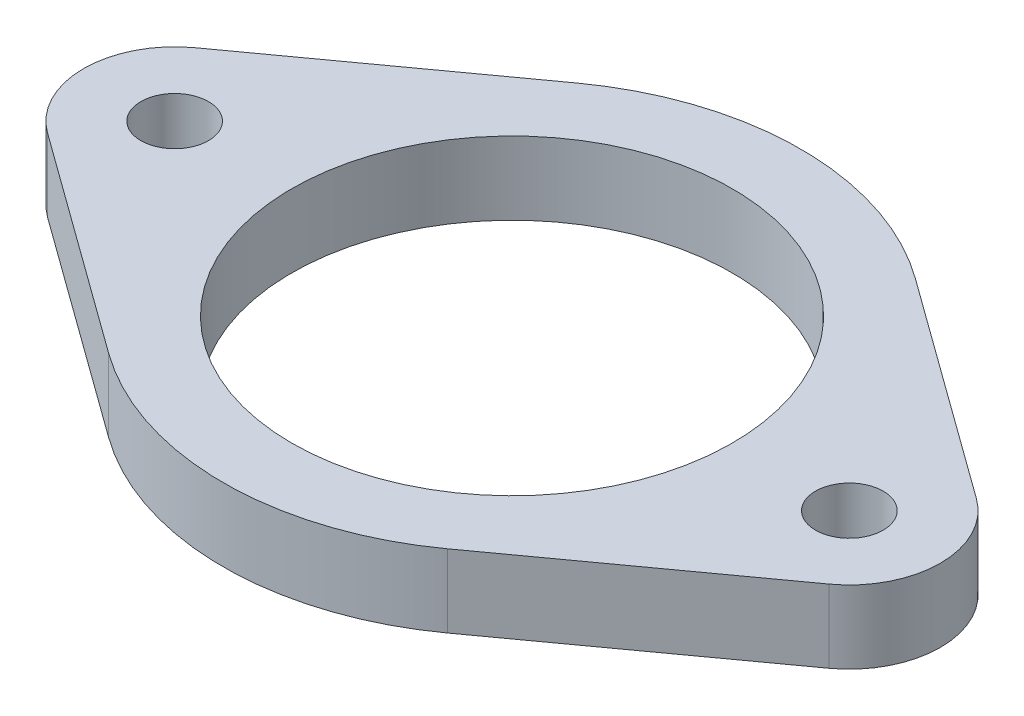
from build123d import *

# Parameters (mm, degrees)
SKETCH1_R           = 9.5885
SKETCH1_R_2         = 1.4732
BOSS_EXTRUDE1_DEPTH = 3.175


with BuildPart() as part:
    # Sketch1 → Boss-Extrude1 (new body)
    with BuildSketch(Plane(origin=(0, 0, 0), x_dir=(1, 0, 0), z_dir=(0, 1, 0))):
        with BuildLine():
            Line((-17.004008462, 3.209626101), (-7.372822991, 10.181965347))
            ThreePointArc((-7.372822991, 10.181965347), (0, 12.570574832), (7.372822991, 10.181965347))
            Line((7.372822991, 10.181965347), (17.004008462, 3.209626101))
            ThreePointArc((17.004008462, 3.209626101), (18.642852126, 0), (17.004008462, -3.209626101))
            Line((17.004008462, -3.209626101), (7.372822991, -10.181965347))
            ThreePointArc((7.372822991, -10.181965347), (0, -12.570574832), (-7.372822991, -10.181965347))
            Line((-7.372822991, -10.181965347), (-17.004008462, -3.209626101))
            ThreePointArc((-17.004008462, -3.209626101), (-18.642852126, 0), (-17.004008462, 3.209626101))
        make_face()
        Circle(SKETCH1_R, mode=Mode.SUBTRACT)
        with Locations((14.6812, 0)):
            Circle(SKETCH1_R_2, mode=Mode.SUBTRACT)
        with Locations((-14.6812, 0)):
            Circle(SKETCH1_R_2, mode=Mode.SUBTRACT)
    extrude(amount=BOSS_EXTRUDE1_DEPTH)


solid = part.part
